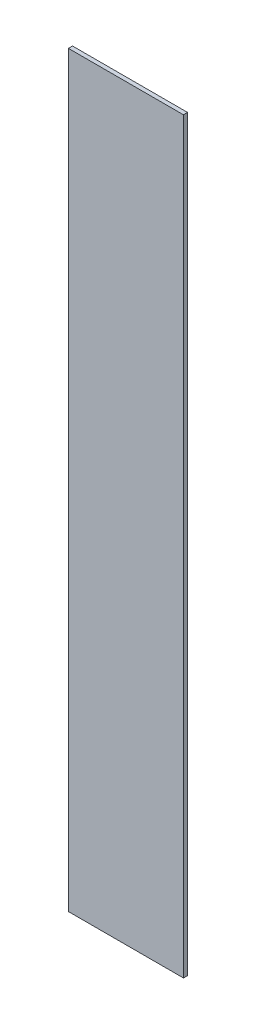
from build123d import *

# Parameters (mm, degrees)
OVEN_FAN_FILTRE_KAPAGI_KULP_CUKURU_1_START = 26
SKETCH1_W                                  = 28
SKETCH1_H                                  = 182
OVEN_FAN_FILTRE_KAPAGI_KULP_CUKURU_1_DEPTH = 1


with BuildPart() as part:
    # Sketch1 → OVEN_fan_filtre_kapagi_kulp_cukuru_1 (new body)
    with BuildSketch(Plane.XY.offset(OVEN_FAN_FILTRE_KAPAGI_KULP_CUKURU_1_START)):
        with Locations((637, 1815)):
            Rectangle(SKETCH1_W, SKETCH1_H)
    extrude(amount=OVEN_FAN_FILTRE_KAPAGI_KULP_CUKURU_1_DEPTH)


solid = part.part
